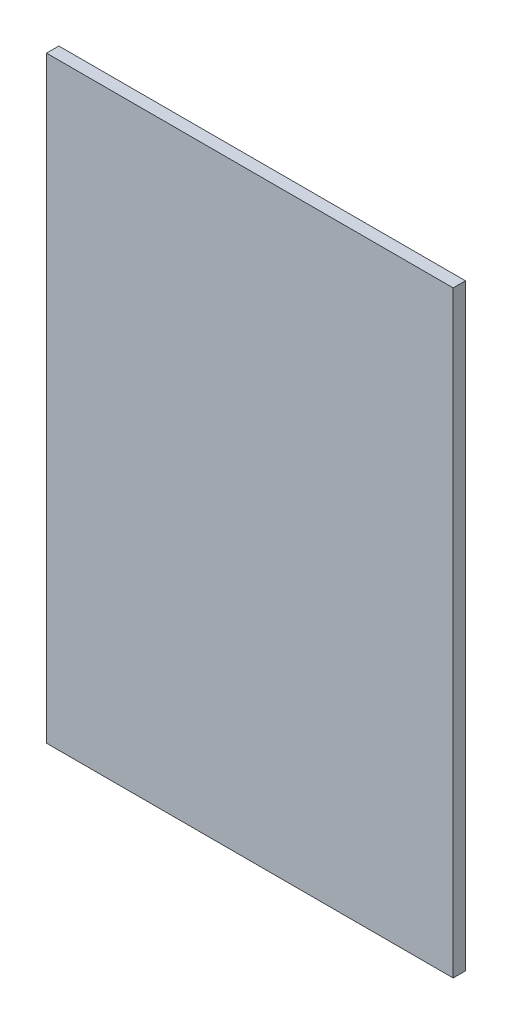
from build123d import *

# Parameters (mm, degrees)
ESQUISSE1_W        = 66
ESQUISSE1_H        = 97
BOSS_EXTRU_1_DEPTH = 2


with BuildPart() as part:
    # Esquisse1 → Boss.-Extru.1 (new body)
    with BuildSketch(Plane.XY):
        with Locations((-24.291605446, 18.489004149)):
            Rectangle(ESQUISSE1_W, ESQUISSE1_H)
    extrude(amount=BOSS_EXTRU_1_DEPTH)


solid = part.part
